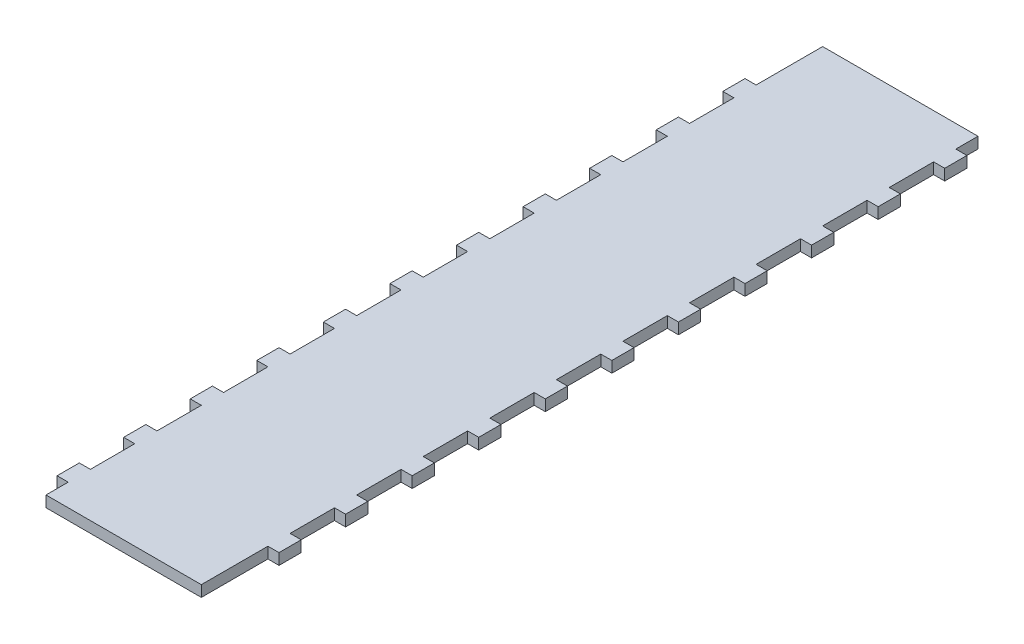
from build123d import *

# Parameters (mm, degrees)
BOSS_EXTRUDE1_DEPTH = 5


with BuildPart() as part:
    # Sketch1 → Boss-Extrude1 (new body)
    with BuildSketch(Plane(origin=(0, 0, 0), x_dir=(1, 0, 0), z_dir=(0, 1, 0))):
        Polygon((-238.169070324, -88.755561118), (-238.169070324, -78.755561118), (-233.169070324, -78.755561118), (-233.169070324, -58.755561118), (-238.169070324, -58.755561118), (-238.169070324, -48.755561118), (-233.169070324, -48.755561118), (-233.169070324, -28.755561118), (-238.169070324, -28.755561118), (-238.169070324, -18.755561118), (-233.169070324, -18.755561118), (-233.169070324, 1.244438882), (-238.169070324, 1.244438882), (-238.169070324, 11.244438882), (-233.169070324, 11.244438882), (-233.169070324, 31.244438882), (-238.169070324, 31.244438882), (-238.169070324, 41.244438882), (-233.169070324, 41.244438882), (-233.169070324, 61.244438882), (-238.169070324, 61.244438882), (-238.169070324, 71.244438882), (-233.169070324, 71.244438882), (-233.169070324, 91.244438882), (-238.169070324, 91.244438882), (-238.169070324, 101.244438882), (-233.169070324, 101.244438882), (-233.169070324, 121.244438882), (-238.169070324, 121.244438882), (-238.169070324, 131.244438882), (-233.169070324, 131.244438882), (-233.169070324, 151.244438882), (-238.169070324, 151.244438882), (-238.169070324, 161.244438882), (-233.169070324, 161.244438882), (-233.169070324, 181.244438882), (-238.169070324, 181.244438882), (-238.169070324, 191.244438882), (-233.169070324, 191.244438882), (-233.169070324, 211.244438882), (-233.169070324, 221.244438882), (-163.169070324, 221.244438882), (-163.169070324, 211.244438882), (-158.169070324, 211.244438882), (-158.169070324, 201.244438882), (-163.169070324, 201.244438882), (-163.169070324, 181.244438882), (-158.169070324, 181.244438882), (-158.169070324, 171.244438882), (-163.169070324, 171.244438882), (-163.169070324, 151.244438882), (-158.169070324, 151.244438882), (-158.169070324, 141.244438882), (-163.169070324, 141.244438882), (-163.169070324, 121.244438882), (-158.169070324, 121.244438882), (-158.169070324, 111.244438882), (-163.169070324, 111.244438882), (-163.169070324, 91.244438882), (-158.169070324, 91.244438882), (-158.169070324, 81.244438882), (-163.169070324, 81.244438882), (-163.169070324, 61.244438882), (-158.169070324, 61.244438882), (-158.169070324, 51.244438882), (-163.169070324, 51.244438882), (-163.169070324, 31.244438882), (-158.169070324, 31.244438882), (-158.169070324, 21.244438882), (-163.169070324, 21.244438882), (-163.169070324, 1.244438882), (-158.169070324, 1.244438882), (-158.169070324, -8.755561118), (-163.169070324, -8.755561118), (-163.169070324, -28.755561118), (-158.169070324, -28.755561118), (-158.169070324, -38.755561118), (-163.169070324, -38.755561118), (-163.169070324, -58.755561118), (-158.169070324, -58.755561118), (-158.169070324, -68.755561118), (-163.169070324, -68.755561118), (-163.169070324, -88.755561118), (-158.169070324, -88.755561118), (-158.169070324, -98.755561118), (-163.169070324, -98.755561118), (-163.169070324, -118.755561118), (-163.169070324, -128.755561118), (-233.169070324, -128.755561118), (-233.169070324, -118.755561118), (-238.169070324, -118.755561118), (-238.169070324, -108.755561118), (-233.169070324, -108.755561118), (-233.169070324, -88.755561118), align=None)
    extrude(amount=BOSS_EXTRUDE1_DEPTH)


solid = part.part
